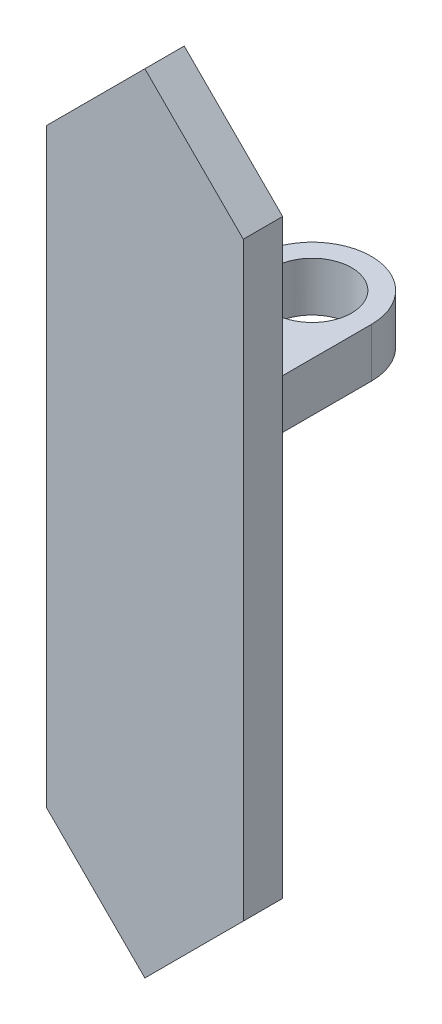
from build123d import *

# Parameters (mm, degrees)
EXTRUDE_1_DEPTH     = 4
SKETCH_2_W          = 12
SKETCH_2_H          = 5
EXTRUDE_2_DEPTH     = 20
SKETCH_6_R          = 4
CUT_EXTRUDE_5_DEPTH = 21


with BuildPart() as part:
    # 草图1 → 凸台-拉伸1 (new body)
    with BuildSketch(Plane.XY):
        Polygon((0.147281285, 10), (0.147281285, 70), (10.147281285, 80), (20.147281285, 70), (20.147281285, 10), (10.147281285, 0), align=None)
    extrude(amount=EXTRUDE_1_DEPTH)

    # 草图2 → 凸台-拉伸2 (add)
    with BuildSketch(Plane(origin=(0, 0, 0), x_dir=(-1, 0, 0), z_dir=(0, 0, -1))):
        with Locations((-10.147281285, 49.5)):
            Rectangle(SKETCH_2_W, SKETCH_2_H)
    extrude(amount=EXTRUDE_2_DEPTH)

    # 草图6 → 切除-拉伸5 (cut)
    with BuildSketch(Plane.XZ.offset(-47)):
        with Locations(Location((10.147281285, -13, 0), (0, 0, 270))):
            Circle(SKETCH_6_R)
        with BuildLine():
            Line((16.147281285, -20), (16.147281285, -13))
            ThreePointArc((16.147281285, -13), (10.147281285, -19), (4.147281285, -13))
            Line((4.147281285, -13), (4.147281285, -20))
            Line((4.147281285, -20), (16.147281285, -20))
        make_face()
    extrude(amount=-CUT_EXTRUDE_5_DEPTH, mode=Mode.SUBTRACT)


solid = part.part
